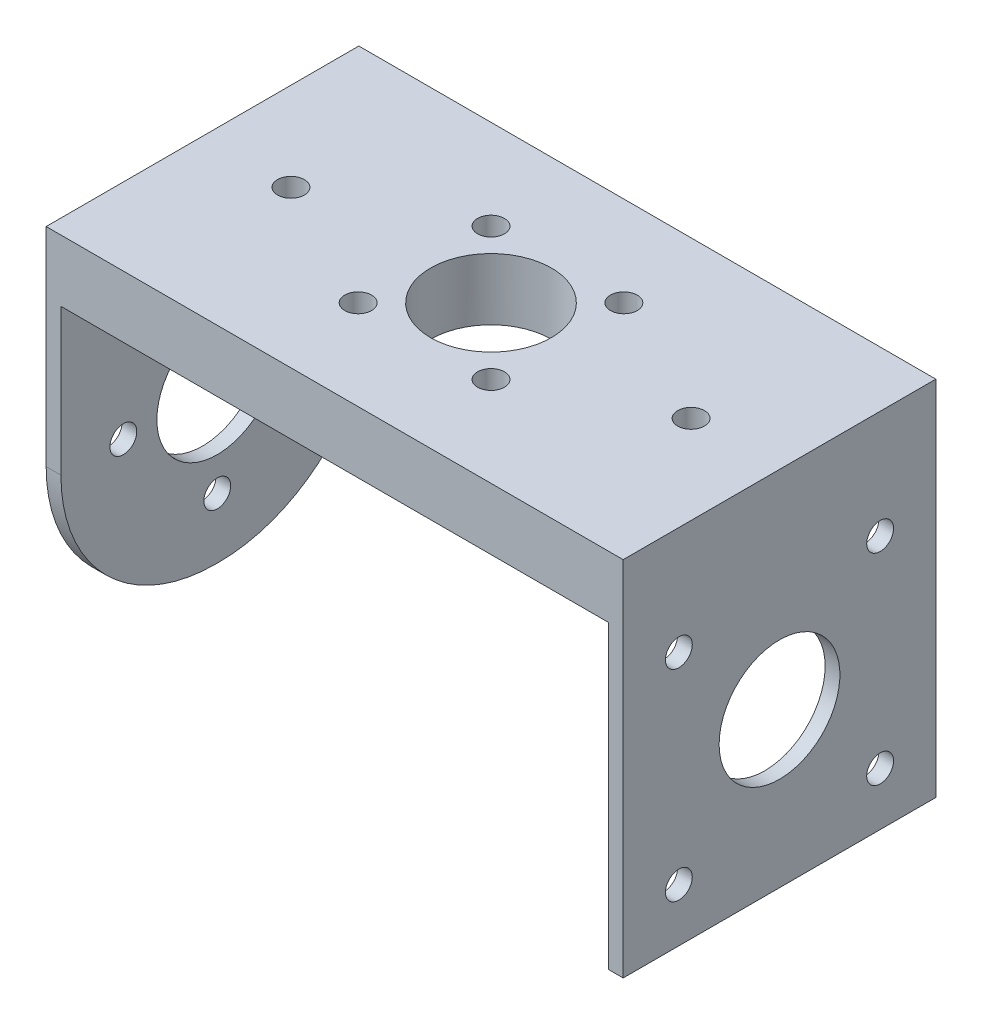
from build123d import *

# Parameters (mm, degrees)
SKETCH1_W                   = 43
SKETCH1_H                   = 23.3
MOUNTPLATE_DEPTH            = 4.6
SKETCH3_R                   = 4.5
AXLEHOLE_MOUNT_DEPTH        = 4.6
SKETCH2_R                   = 1
MOUNTHOLES_DEPTH            = 4.6
SKETCH4_W                   = 1.1
SKETCH4_H                   = 23.3
SERVOLEGS_DEPTH             = 22.4
CENTERHOLES_REACH           = 55.793
SKETCH5_R                   = 4.5
SKETCH6_R                   = 1
ROTORSIDE_MOUNTHOLES_DEPTH  = 1.1
FILLET1_R                   = 11.5
FILLET2_R                   = 11.5
SKETCH7_R                   = 1
SLIDERSIDE_MOUNTHOLES_DEPTH = 1.1


with BuildPart() as part:
    # Sketch1 → MountPlate (new body)
    with BuildSketch(Plane(origin=(0, 0, 0), x_dir=(1, 0, 0), z_dir=(0, 1, 0))):
        with Locations((21.5, 11.65)):
            Rectangle(SKETCH1_W, SKETCH1_H)
    extrude(amount=MOUNTPLATE_DEPTH)

    # Sketch3 → AxleHole-Mount (cut)
    with BuildSketch(Plane(origin=(0, 4.6, 0), x_dir=(1, 0, 0), z_dir=(0, 1, 0))):
        with Locations(Location((21.5, 11.65, 0), (0, 0, 270))):
            Circle(SKETCH3_R)
    extrude(amount=-AXLEHOLE_MOUNT_DEPTH, mode=Mode.SUBTRACT)

    # Sketch2 → MountHoles (cut)
    with BuildSketch(Plane(origin=(0, 4.6, 0), x_dir=(1, 0, 0), z_dir=(0, 1, 0))):
        with Locations(Location((6.59, 11.65, 0), (0, 0, 270))):
            Circle(SKETCH2_R)
        with Locations(Location((16.550252532, 6.700252532, 0), (0, 0, 270))):
            Circle(SKETCH2_R)
        with Locations(Location((36.41, 11.65, 0), (0, 0, 270))):
            Circle(SKETCH2_R)
        with Locations(Location((16.550252532, 16.599747468, 0), (0, 0, 270))):
            Circle(SKETCH2_R)
        with Locations(Location((26.449747468, 16.599747468, 0), (0, 0, 270))):
            Circle(SKETCH2_R)
        with Locations(Location((26.449747468, 6.700252532, 0), (0, 0, 270))):
            Circle(SKETCH2_R)
    extrude(amount=-MOUNTHOLES_DEPTH, mode=Mode.SUBTRACT)

    # Sketch4 → ServoLegs (add)
    with BuildSketch(Plane.XZ):
        with Locations((42.45, -11.65)):
            Rectangle(SKETCH4_W, SKETCH4_H)
        with Locations((0.55, -11.65)):
            Rectangle(SKETCH4_W, SKETCH4_H)
    extrude(amount=SERVOLEGS_DEPTH)

    # CenterHoles: up to this face of the body (flat: up to its plane)
    centerholes_end = Plane(part.part.faces().sort_by_distance((43, -8.9, -11.65))[0])
    # Sketch5 → CenterHoles (cut, up to the picked face)
    with BuildSketch(Plane.ZY, mode=Mode.PRIVATE) as centerholes_sk1:
        with Locations((-11.65, -10.9)):
            Circle(SKETCH5_R)
    centerholes_tool1 = split(extrude(centerholes_sk1.sketch, amount=-CENTERHOLES_REACH, mode=Mode.PRIVATE), bisect_by=centerholes_end, keep=Keep.BOTH, mode=Mode.PRIVATE)
    add(centerholes_tool1.solids().sort_by(Axis((0, -10.9, -11.65), (1, 0, 0)))[0], mode=Mode.SUBTRACT)

    # Sketch6 → RotorSide-MountHoles (cut)
    with BuildSketch(Plane.ZY):
        with Locations((-11.65, -17.9)):
            Circle(SKETCH6_R)
        with Locations((-18.65, -10.9)):
            Circle(SKETCH6_R)
        with Locations((-11.65, -3.9)):
            Circle(SKETCH6_R)
        with Locations((-4.65, -10.9)):
            Circle(SKETCH6_R)
    extrude(amount=-ROTORSIDE_MOUNTHOLES_DEPTH, mode=Mode.SUBTRACT)

    # Fillet1
    fillet1_edges = [part.edges().sort_by_distance(p)[0] for p in [
        (0.55, -22.4, -23.3),
    ]]
    fillet(fillet1_edges, radius=FILLET1_R)

    # Fillet2
    fillet2_edges = [part.edges().sort_by_distance(p)[0] for p in [
        (0.55, -22.4, 0),
    ]]
    fillet(fillet2_edges, radius=FILLET2_R)

    # Sketch7 → SliderSide-MountHoles (cut)
    with BuildSketch(Plane(origin=(43, 0, 0), x_dir=(0, 0, -1), z_dir=(1, 0, 0))):
        with Locations((19.15, -18.45)):
            Circle(SKETCH7_R)
        with Locations((19.15, -3.45)):
            Circle(SKETCH7_R)
        with Locations((4.15, -3.45)):
            Circle(SKETCH7_R)
        with Locations((4.15, -18.45)):
            Circle(SKETCH7_R)
    extrude(amount=-SLIDERSIDE_MOUNTHOLES_DEPTH, mode=Mode.SUBTRACT)


solid = part.part
